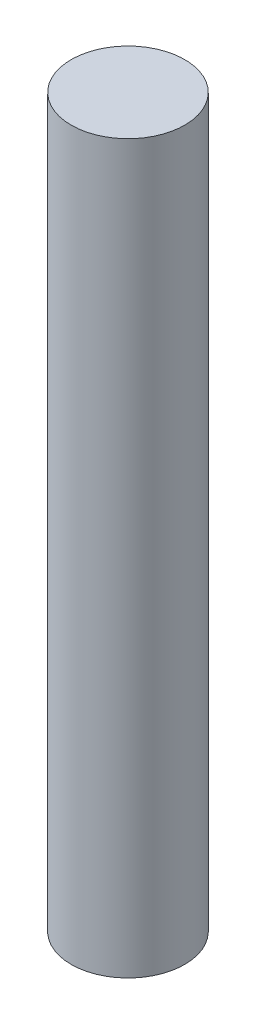
from build123d import *

# Parameters (mm, degrees)
SKETCH1_R           = 2.5
BOSS_EXTRUDE1_DEPTH = 32


with BuildPart() as part:
    # Sketch1 → Boss-Extrude1 (new body)
    with BuildSketch(Plane(origin=(0, 0, 0), x_dir=(1, 0, 0), z_dir=(0, 1, 0))):
        with Locations(Location((-25.616053806, 7.189960557, 0), (0, 0, 270))):
            Circle(SKETCH1_R)
    extrude(amount=BOSS_EXTRUDE1_DEPTH)


solid = part.part
